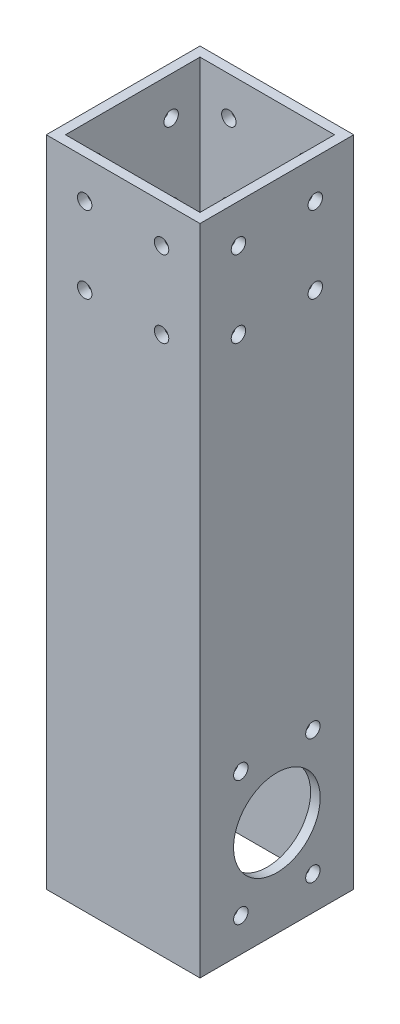
from build123d import *

# Parameters (mm, degrees)
SKETCH1_W           = 50.8
SKETCH1_H           = 50.8
BOSS_EXTRUDE1_DEPTH = 215.9
SHELL1_T            = -3.175
SKETCH2_R           = 14.3129
CUT_EXTRUDE1_DEPTH  = 224.245627057
SKETCH3_R           = 2.38125
CUT_EXTRUDE2_DEPTH  = 224.245627057
SKETCH4_R           = 2.38125
CUT_EXTRUDE3_DEPTH  = 224.245627057
SKETCH5_R           = 2.38125
CUT_EXTRUDE4_DEPTH  = 224.245627057


with BuildPart() as part:
    # Sketch1 → Boss-Extrude1 (new body)
    with BuildSketch(Plane(origin=(0, 0, 0), x_dir=(1, 0, 0), z_dir=(0, 1, 0))):
        Rectangle(SKETCH1_W, SKETCH1_H)
    extrude(amount=BOSS_EXTRUDE1_DEPTH)

    # Shell1
    shell1_openings = [part.faces().sort_by_distance(p)[0] for p in [
        (0, 215.9, 0),
        (0, 0, 0),
    ]]
    offset(amount=SHELL1_T, openings=shell1_openings, kind=Kind.INTERSECTION)

    # Sketch2 → Cut-Extrude1 (cut, through all)
    with BuildSketch(Plane(origin=(25.4, 0, 0), x_dir=(0, 0, -1), z_dir=(1, 0, 0))):
        with Locations((0, 31.75)):
            Circle(SKETCH2_R)
    extrude(amount=-CUT_EXTRUDE1_DEPTH, mode=Mode.SUBTRACT)

    # Sketch3 → Cut-Extrude2 (cut, through all)
    with BuildSketch(Plane(origin=(25.4, 0, 0), x_dir=(0, 0, -1), z_dir=(1, 0, 0))):
        with Locations((-11.90625, 52.372229928)):
            Circle(SKETCH3_R)
        with Locations((11.90625, 52.372229928)):
            Circle(SKETCH3_R)
        with Locations((-11.90625, 11.127770072)):
            Circle(SKETCH3_R)
        with Locations((11.90625, 11.127770072)):
            Circle(SKETCH3_R)
    extrude(amount=-CUT_EXTRUDE2_DEPTH, mode=Mode.SUBTRACT)

    # Sketch4 → Cut-Extrude3 (cut, through all)
    with BuildSketch(Plane(origin=(25.4, 0, 0), x_dir=(0, 0, -1), z_dir=(1, 0, 0))):
        with Locations((-12.7, 203.2)):
            Circle(SKETCH4_R)
        with Locations((12.7, 203.2)):
            Circle(SKETCH4_R)
        with Locations((12.7, 177.8)):
            Circle(SKETCH4_R)
        with Locations((-12.7, 177.8)):
            Circle(SKETCH4_R)
    extrude(amount=-CUT_EXTRUDE3_DEPTH, mode=Mode.SUBTRACT)

    # Sketch5 → Cut-Extrude4 (cut, through all)
    with BuildSketch(Plane.XY.offset(25.4)):
        with Locations((-12.7, 203.2)):
            Circle(SKETCH5_R)
        with Locations((12.7, 203.2)):
            Circle(SKETCH5_R)
        with Locations((12.7, 177.8)):
            Circle(SKETCH5_R)
        with Locations((-12.7, 177.8)):
            Circle(SKETCH5_R)
    extrude(amount=-CUT_EXTRUDE4_DEPTH, mode=Mode.SUBTRACT)


solid = part.part
